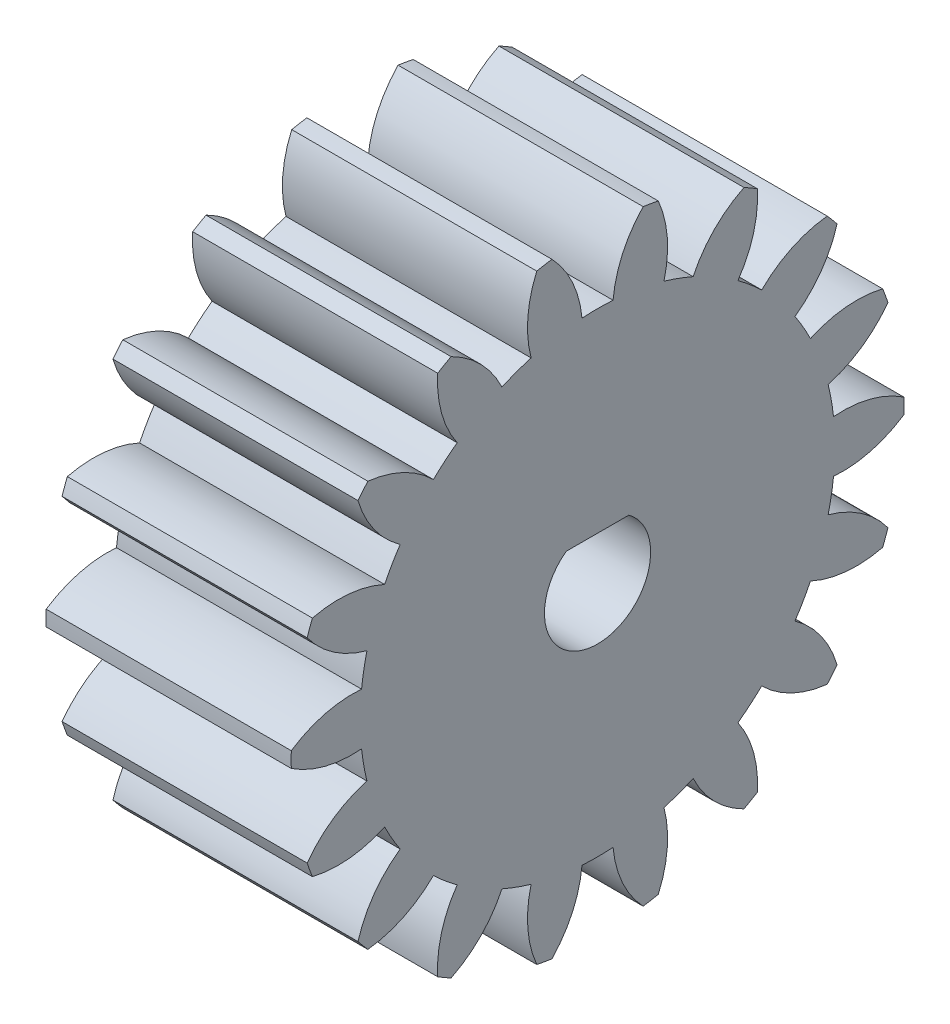
from build123d import *

# Parameters (mm, degrees)
BASPROSKE_W         = 12
BASPROSKE_H         = 15
TOOTHCUT_DEPTH      = 25.372115214
TEETHCUTS_COUNT     = 18
TEETHCUTS_ANGLE     = 340
BORSKE_R            = 2.5
BORE_DEPTH          = 50.0000508
SKETCH_1_R          = 2.6
CUT_EXTRUDE_1_DEPTH = 25.269634752
EXTRUDE_2_DEPTH     = 12


with BuildPart() as part:
    # BasProSke → Base-Revolve (revolve)
    with BuildSketch(Plane(origin=(0, 0, 0), x_dir=(1, 0, 0), z_dir=(0, 1, 0)), mode=Mode.PRIVATE) as base_revolve_sk:
        with Locations((6, 7.5)):
            Rectangle(BASPROSKE_W, BASPROSKE_H)
    revolve(base_revolve_sk.sketch.rotate(Axis((-10, 0, 0), (1, 0, 0)), 180), axis=Axis((-10, 0, 0), (1, 0, 0)))

    # TooCutSke → ToothCut (cut, through all)
    with BuildSketch(Plane(origin=(0, 0, 0), x_dir=(0, 0, -1), z_dir=(1, 0, 0))):
        with BuildLine():
            ThreePointArc((0.759974923, 11.599129886), (0, 11.624), (-0.759974923, 11.599129886))
            ThreePointArc((-0.759974923, 11.599129886), (-1.229186471, 13.354767823), (-2.254227748, 14.855339189))
            ThreePointArc((-2.254227748, 14.855339189), (0, 15.0254), (2.254227748, 14.855339189))
            ThreePointArc((2.254227748, 14.855339189), (1.229186471, 13.354767823), (0.759974923, 11.599129886))
        make_face()
    toothcut = extrude(amount=TOOTHCUT_DEPTH, mode=Mode.SUBTRACT)

    # TeethCuts: ToothCut ×18 about axis
    teethcuts_axis = Axis((-10, 0, 0), (1, 0, 0))
    for i in range(1, TEETHCUTS_COUNT):
        add(toothcut.rotate(teethcuts_axis, i * TEETHCUTS_ANGLE / (TEETHCUTS_COUNT - 1)), mode=Mode.SUBTRACT)

    # BorSke → Bore (cut, symmetric)
    with BuildSketch(Plane(origin=(0, 0, 0), x_dir=(0, 0, -1), z_dir=(1, 0, 0))):
        with Locations(Location((0, 0, 0), (0, 0, 180))):
            Circle(BORSKE_R)
    extrude(amount=BORE_DEPTH, both=True, mode=Mode.SUBTRACT)

    # 草圖1 → 除料-伸長1 (cut, through all)
    with BuildSketch(Plane(origin=(12, 0, 0), x_dir=(0, 0, -1), z_dir=(1, 0, 0))):
        Circle(SKETCH_1_R)
    extrude(amount=-CUT_EXTRUDE_1_DEPTH, mode=Mode.SUBTRACT)

    # 草圖2 → 填料-伸長2 (add, through all)
    with BuildSketch(Plane(origin=(12, 0, 0), x_dir=(0, 0, -1), z_dir=(1, 0, 0))):
        with BuildLine():
            Line((0, 2.1), (1.532970972, 2.1))
            ThreePointArc((1.532970972, 2.1), (0, 2.6), (-1.532970972, 2.1))
            Line((-1.532970972, 2.1), (0, 2.1))
        make_face()
    extrude(amount=-EXTRUDE_2_DEPTH)


solid = part.part
